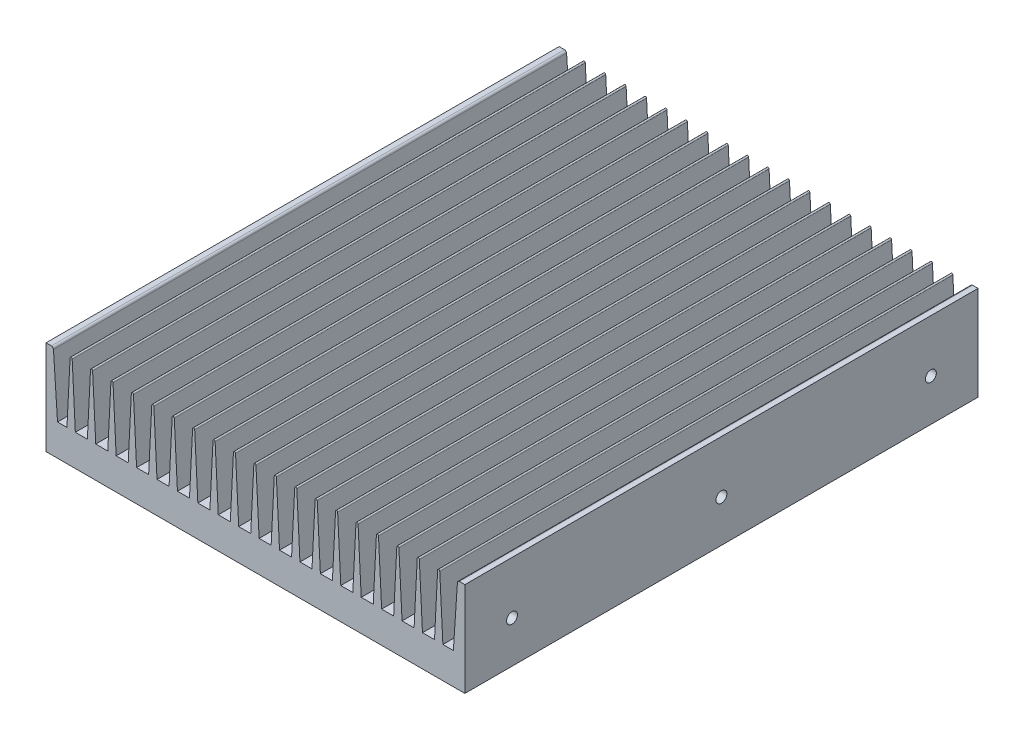
from build123d import *

# Parameters (mm, degrees)
EXTRUDE_1_DEPTH       = 245
EXTRUDE_3_DEPTH       = 245
PATTERN_CURVE_1_COUNT = 19
PATTERN_CURVE_1_PITCH = 9.75
SKETCH_7_R            = 2.6
CUT_EXTRUDE_4_DEPTH   = 6
CUT_EXTRUDE_START     = -8
SKETCH_13_R           = 2.6
CUT_EXTRUDE_9_DEPTH   = 8
SKETCH_15_R           = 1.6
SKETCH_15_R_2         = 1.3
SKETCH_15_R_3         = 2.6
CUT_EXTRUDE_10_DEPTH  = 10


with BuildPart() as part:
    # Эскиз1 → Вытянуть1 (new body)
    with BuildSketch(Plane.XY):
        with BuildLine():
            Line((0, 45), (2.564446908, 45))
            ThreePointArc((2.564446908, 45), (3.247630994, 44.730246195), (3.562232066, 44.066519011))
            Line((3.562232066, 44.066519011), (5.5, 15))
            Line((5.5, 15), (194.5, 15))
            Line((194.5, 15), (196.437767934, 44.066519011))
            ThreePointArc((196.437767934, 44.066519011), (196.752369006, 44.730246195), (197.435553092, 45))
            Line((197.435553092, 45), (200, 45))
            Line((200, 45), (200, 0))
            Line((200, 0), (0, 0))
            Line((0, 0), (0, 45))
        make_face()
    extrude(amount=EXTRUDE_1_DEPTH)

    # Эскиз2 → Вытянуть3 (add)
    with BuildSketch(Plane.XY.offset(245)):
        with BuildLine():
            Line((11.5, 44.5), (10, 15))
            Line((10, 15), (14, 15))
            Line((14, 15), (12.5, 44.5))
            ThreePointArc((12.5, 44.5), (12, 45), (11.5, 44.5))
        make_face()
    extrude_3 = extrude(amount=-EXTRUDE_3_DEPTH)

    # Кривая1: Вытянуть3 ×19
    with Locations(*[(i * PATTERN_CURVE_1_PITCH, 0, 0) for i in range(1, PATTERN_CURVE_1_COUNT)]):
        add(extrude_3)

    # Эскиз7 → Вырез-Вытянуть4 (cut)
    with BuildSketch(Plane.ZY):
        with Locations(Location((22.5, 20, 0), (0, 0, 270))):
            Circle(SKETCH_7_R)
        with Locations(Location((222.5, 20, 0), (0, 0, 270))):
            Circle(SKETCH_7_R)
        with Locations(Location((122.5, 20, 0), (0, 0, 270))):
            Circle(SKETCH_7_R)
    extrude(amount=-CUT_EXTRUDE_4_DEPTH, mode=Mode.SUBTRACT)

    # Эскиз13 → Вырез-Вытянуть9 (cut)
    with BuildSketch(Plane(origin=(200, 0, 0), x_dir=(0, 0, -1), z_dir=(1, 0, 0)).offset(CUT_EXTRUDE_START)):
        with Locations(Location((-222.5, 20, 0), (0, 0, 270))):
            Circle(SKETCH_13_R)
        with Locations(Location((-122.5, 20, 0), (0, 0, 270))):
            Circle(SKETCH_13_R)
        with Locations(Location((-22.5, 20, 0), (0, 0, 270))):
            Circle(SKETCH_13_R)
    extrude(amount=CUT_EXTRUDE_9_DEPTH, mode=Mode.SUBTRACT)

    # Эскиз15 → Вырез-Вытянуть10 (cut)
    with BuildSketch(Plane.XZ):
        with Locations((25, 220)):
            Circle(SKETCH_15_R)
        with Locations((175, 220)):
            Circle(SKETCH_15_R)
        with Locations((175, 110)):
            Circle(SKETCH_15_R)
        with Locations((25, 110)):
            Circle(SKETCH_15_R)
        with Locations((55, 182)):
            Circle(SKETCH_15_R_2)
        with Locations((55, 148.5)):
            Circle(SKETCH_15_R_2)
        with Locations((93, 195)):
            Circle(SKETCH_15_R_3)
    extrude(amount=-CUT_EXTRUDE_10_DEPTH, mode=Mode.SUBTRACT)


solid = part.part
